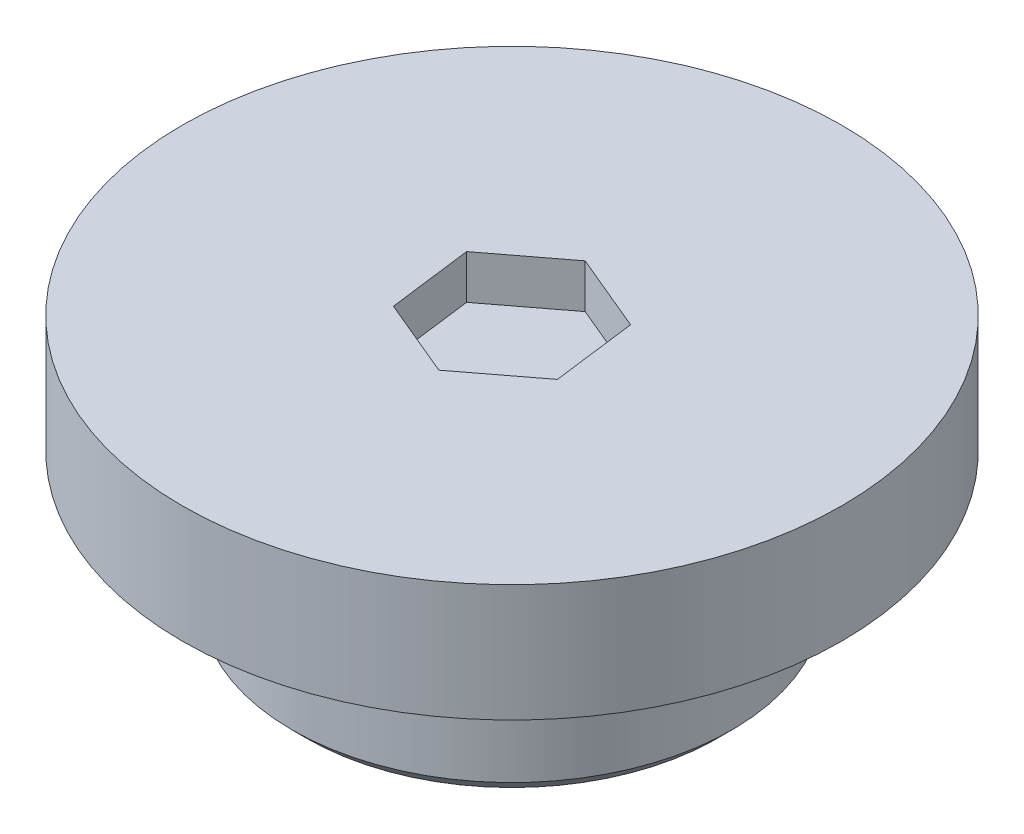
from build123d import *

# Parameters (mm, degrees)
SKETCH1_R           = 15
BOSS_EXTRUDE1_DEPTH = 10
SKETCH2_R           = 22.5
BOSS_EXTRUDE2_DEPTH = 8
CHAMFER1_SIZE       = 1
SKETCH3_R           = 10
CUT_EXTRUDE1_DEPTH  = 10
CUT_EXTRUDE2_DEPTH  = 3
CHAMFER2_SIZE       = 1


with BuildPart() as part:
    # Sketch1 → Boss-Extrude1 (new body)
    with BuildSketch(Plane(origin=(0, 0, 0), x_dir=(1, 0, 0), z_dir=(0, 1, 0))):
        with Locations(Location((0, 0, 0), (0, 0, 270))):
            Circle(SKETCH1_R)
    extrude(amount=BOSS_EXTRUDE1_DEPTH)

    # Sketch2 → Boss-Extrude2 (add)
    with BuildSketch(Plane(origin=(0, 10, 0), x_dir=(1, 0, 0), z_dir=(0, 1, 0))):
        with Locations(Location((0, 0, 0), (0, 0, 270))):
            Circle(SKETCH2_R)
    extrude(amount=BOSS_EXTRUDE2_DEPTH)

    # Chamfer1
    chamfer1_edges = [part.edges().sort_by_distance(p)[0] for p in [
        (0, 0, -15),
    ]]
    chamfer(chamfer1_edges, length=CHAMFER1_SIZE)

    # Sketch3 → Cut-Extrude1 (cut)
    with BuildSketch(Plane.XZ):
        with Locations(Location((0, 0, 0), (0, 0, 270))):
            Circle(SKETCH3_R)
    extrude(amount=-CUT_EXTRUDE1_DEPTH, mode=Mode.SUBTRACT)

    # Sketch4 → Cut-Extrude2 (cut)
    with BuildSketch(Plane(origin=(0, 18, 0), x_dir=(1, 0, 0), z_dir=(0, 1, 0))):
        Polygon((5.326189108, -2.228237625), (4.592804943, 3.49849626), (-0.733384165, 5.726733886), (-5.326189108, 2.228237625), (-4.592804943, -3.49849626), (0.733384165, -5.726733886), align=None)
    extrude(amount=-CUT_EXTRUDE2_DEPTH, mode=Mode.SUBTRACT)

    # Chamfer2
    chamfer2_edges = [part.edges().sort_by_distance(p)[0] for p in [
        (0, 0, 10),
    ]]
    chamfer(chamfer2_edges, length=CHAMFER2_SIZE)


solid = part.part
